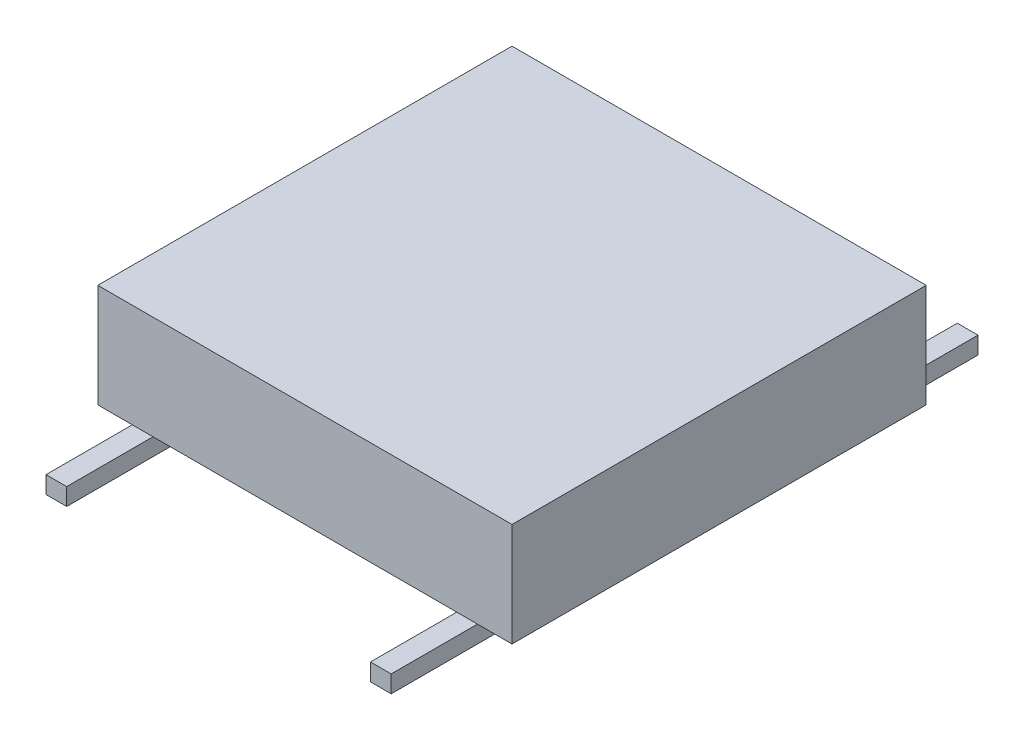
from build123d import *

# Parameters (mm, degrees)
SKETCH1_W           = 12
SKETCH1_H           = 12
BOSS_EXTRUDE1_DEPTH = 3
SKETCH2_W           = 0.6
SKETCH2_H           = 0.5
BOSS_EXTRUDE2_DEPTH = 2.5


with BuildPart() as part:
    # Sketch1 → Boss-Extrude1 (new body)
    with BuildSketch(Plane(origin=(0, 0, 0), x_dir=(1, 0, 0), z_dir=(0, 1, 0))):
        Rectangle(SKETCH1_W, SKETCH1_H)
    extrude(amount=BOSS_EXTRUDE1_DEPTH)

    # Sketch2 → Boss-Extrude2 (add, symmetric)
    with BuildSketch(Plane.XY.offset(6)):
        with Locations((4.7, -0.25)):
            Rectangle(SKETCH2_W, SKETCH2_H)
        with Locations((-4.7, -0.25)):
            Rectangle(SKETCH2_W, SKETCH2_H)
    boss_extrude2 = extrude(amount=BOSS_EXTRUDE2_DEPTH, both=True)

    # Mirror1: Boss-Extrude2 across plane
    add(boss_extrude2.mirror(Plane.XY))


solid = part.part
